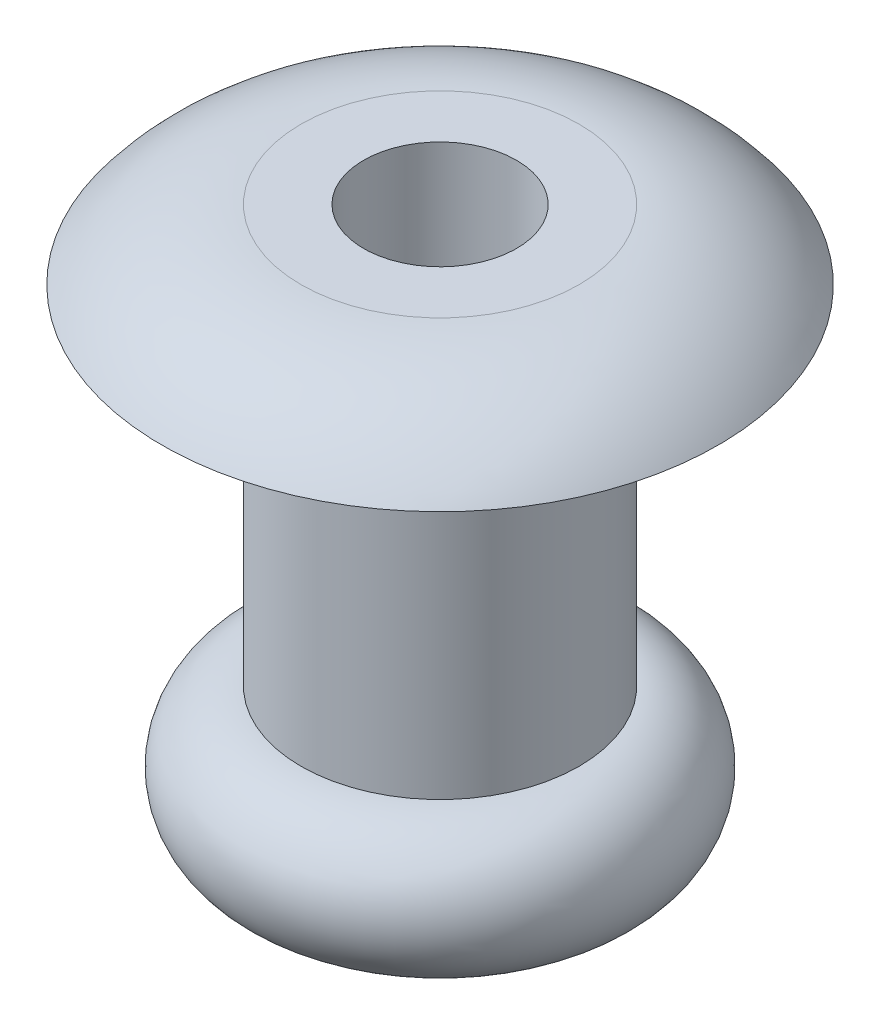
from build123d import *


with BuildPart() as part:
    # Эскиз1 → Повернуть1 (revolve)
    with BuildSketch(Plane.XY, mode=Mode.PRIVATE) as revolve_1_sk:
        with BuildLine():
            Line((1.1, 1), (2, 1))
            ThreePointArc((2, 1), (3.118033989, 0.736067977), (4, 0))
            Line((4, 0), (2, 0))
            Line((2, 0), (2, -5))
            ThreePointArc((2, -5), (3, -6), (2, -7))
            Line((2, -7), (1.1, -7))
            Line((1.1, -7), (1.1, 1))
        make_face()
    revolve(revolve_1_sk.sketch.rotate(Axis((0, -12.837811583, 0), (0, 1, 0)), 90), axis=Axis((0, -12.837811583, 0), (0, 1, 0)))


solid = part.part
